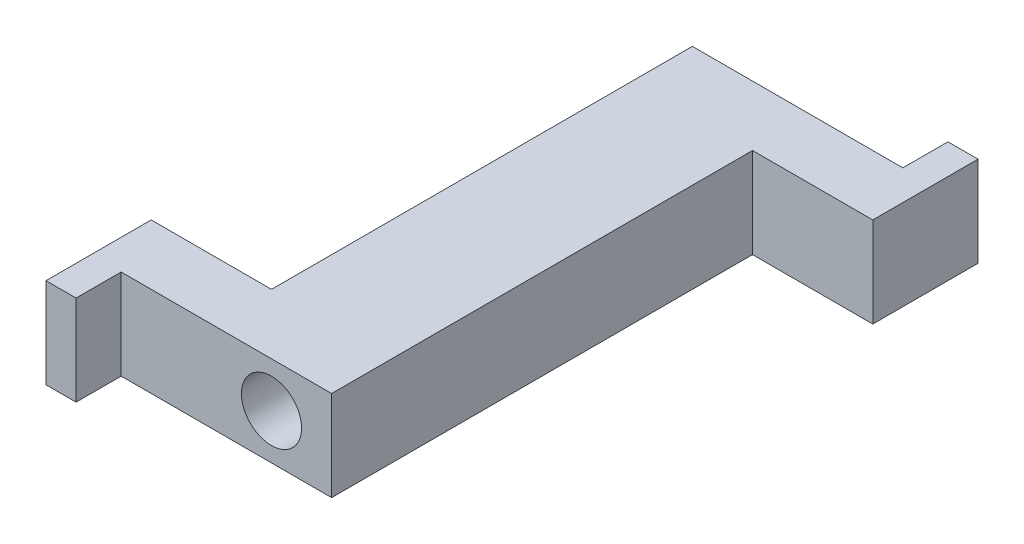
from build123d import *

# Parameters (mm, degrees)
SKETCH1_W           = 25.4
SKETCH1_H           = 19.05
BOSS_EXTRUDE1_DEPTH = 101.6
SKETCH2_R           = 6.35
CUT_EXTRUDE1_DEPTH  = 101.6
SKETCH3_W           = 25.4
SKETCH3_H           = 12.7
BOSS_EXTRUDE2_DEPTH = 19.05
SKETCH5_W           = 6.35
SKETCH5_H           = 19.05
BOSS_EXTRUDE4_DEPTH = 9.525
SKETCH8_W           = 25.4
SKETCH8_H           = 12.7
BOSS_EXTRUDE5_DEPTH = 19.05
SKETCH9_W           = 6.35
SKETCH9_H           = 19.05
BOSS_EXTRUDE6_DEPTH = 9.525


with BuildPart() as part:
    # Sketch1 → Boss-Extrude1 (new body)
    with BuildSketch(Plane.XY):
        with Locations((-12.7, 9.525)):
            Rectangle(SKETCH1_W, SKETCH1_H)
    extrude(amount=BOSS_EXTRUDE1_DEPTH)

    # Sketch2 → Cut-Extrude1 (cut)
    with BuildSketch(Plane.XY.offset(101.6)):
        with Locations((-12.7, 9.525)):
            Circle(SKETCH2_R)
    extrude(amount=-CUT_EXTRUDE1_DEPTH, mode=Mode.SUBTRACT)

    # Sketch3 → Boss-Extrude2 (add)
    with BuildSketch(Plane(origin=(0, 19.05, 0), x_dir=(1, 0, 0), z_dir=(0, 1, 0))):
        with Locations((-38.1, -95.25)):
            Rectangle(SKETCH3_W, SKETCH3_H)
    extrude(amount=-BOSS_EXTRUDE2_DEPTH)

    # Sketch5 → Boss-Extrude4 (add)
    with BuildSketch(Plane.XY.offset(101.6)):
        with Locations((-47.625, 9.525)):
            Rectangle(SKETCH5_W, SKETCH5_H)
    extrude(amount=BOSS_EXTRUDE4_DEPTH)

    # Sketch8 → Boss-Extrude5 (add)
    with BuildSketch(Plane(origin=(0, 19.05, 0), x_dir=(1, 0, 0), z_dir=(0, 1, 0))):
        with Locations((12.7, -6.35)):
            Rectangle(SKETCH8_W, SKETCH8_H)
    extrude(amount=-BOSS_EXTRUDE5_DEPTH)

    # Sketch9 → Boss-Extrude6 (add)
    with BuildSketch(Plane(origin=(0, 0, 0), x_dir=(-1, 0, 0), z_dir=(0, 0, -1))):
        with Locations((-22.225, 9.525)):
            Rectangle(SKETCH9_W, SKETCH9_H)
    extrude(amount=BOSS_EXTRUDE6_DEPTH)


solid = part.part
